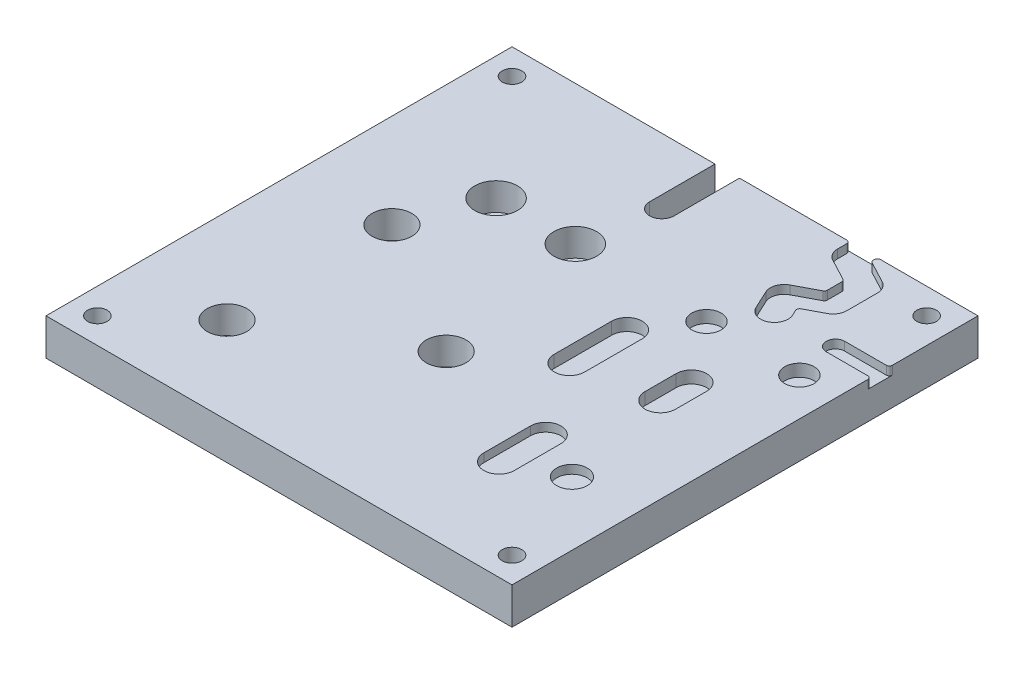
from build123d import *

# Parameters (mm, degrees)
BASE_PLATE_R        = 1.6
EXTRUDE_1_DEPTH     = 6
CUT_EXTRUDE_START   = -6
SKETCH_1_R          = 3.25
SKETCH_1_R_2        = 3.5
CUT_EXTRUDE_1_DEPTH = 4.5
SKETCH_1_6_R        = 2.4
CUT_EXTRUDE_2_DEPTH = 2
SKETCH_1_7_R        = 2.5
CUT_EXTRUDE_3_DEPTH = 1.4
FILLET_2_R          = 0.5


with BuildPart() as part:
    # Base plate → 凸台-拉伸1 (new body)
    with BuildSketch(Plane(origin=(0, 0, 0), x_dir=(1, 0, 0), z_dir=(0, 1, 0))):
        with BuildLine():
            Line((-38.1, -38.1), (38.1, -38.1))
            Line((38.1, -38.1), (38.1, 38.1))
            Line((38.1, 38.1), (-0.9, 38.1))
            Line((-0.9, 38.1), (-0.9, 27.4))
            ThreePointArc((-0.9, 27.4), (-2.9, 25.4), (-4.9, 27.4))
            Line((-4.9, 27.4), (-4.9, 38.1))
            Line((-4.9, 38.1), (-38.1, 38.1))
            Line((-38.1, 38.1), (-38.1, -38.1))
        make_face()
        with Locations(Location((-33.9, -33.9, 0), (0, 0, 270))):
            Circle(BASE_PLATE_R, mode=Mode.SUBTRACT)
        with Locations(Location((33.9, -33.9, 0), (0, 0, 270))):
            Circle(BASE_PLATE_R, mode=Mode.SUBTRACT)
        with Locations(Location((-33.9, 33.9, 0), (0, 0, 270))):
            Circle(BASE_PLATE_R, mode=Mode.SUBTRACT)
        with Locations(Location((33.9, 33.9, 0), (0, 0, 270))):
            Circle(BASE_PLATE_R, mode=Mode.SUBTRACT)
    extrude(amount=EXTRUDE_1_DEPTH)

    # 草图1 → 切除-拉伸1 (cut)
    with BuildSketch(Plane.XZ.offset(CUT_EXTRUDE_START)):
        with Locations(Location((-0.35, 10.415, 0), (0, 0, 90))):
            Circle(SKETCH_1_R)
        with Locations(Location((-22.7, 23.9, 0), (0, 0, 90))):
            Circle(SKETCH_1_R)
        with Locations(Location((-22.7, -3.07, 0), (0, 0, 90))):
            Circle(SKETCH_1_R)
        with Locations(Location((-17.96, -15.36, 0), (0, 0, 90))):
            Circle(SKETCH_1_R_2)
        with Locations(Location((-5.01, -15.36, 0), (0, 0, 90))):
            Circle(SKETCH_1_R_2)
    extrude(amount=CUT_EXTRUDE_1_DEPTH, mode=Mode.SUBTRACT)

    # 草图1<6> → 切除-拉伸2 (cut)
    with BuildSketch(Plane.XZ.offset(CUT_EXTRUDE_START)):
        with BuildLine():
            Line((8.9, 2), (8.9, -7.4))
            ThreePointArc((8.9, -7.4), (11.4, -9.9), (13.9, -7.4))
            Line((13.9, -7.4), (13.9, 2))
            ThreePointArc((13.9, 2), (11.4, 4.5), (8.9, 2))
        make_face()
        with BuildLine():
            Line((21.6, -0.16), (21.6, -5.24))
            ThreePointArc((21.6, -5.24), (24.1, -7.74), (26.6, -5.24))
            Line((26.6, -5.24), (26.6, -0.16))
            ThreePointArc((26.6, -0.16), (24.1, 2.34), (21.6, -0.16))
        make_face()
        with Locations(Location((31.9, -15.1, 0), (0, 0, 90))):
            Circle(SKETCH_1_6_R)
        with Locations(Location((16.7, -15.1, 0), (0, 0, 90))):
            Circle(SKETCH_1_6_R)
    extrude(amount=CUT_EXTRUDE_2_DEPTH, mode=Mode.SUBTRACT)

    # 草图1<7> → 切除-拉伸3 (cut)
    with BuildSketch(Plane.XZ.offset(CUT_EXTRUDE_START)):
        with BuildLine():
            Line((17.15, -38.1), (21.65, -38.1))
            Line((21.65, -38.1), (21.65, -37.1))
            Line((21.65, -37.1), (21.65, -36.1))
            ThreePointArc((21.65, -36.1), (20.560909108, -34.172620939), (18.347964405, -34.111100529))
            ThreePointArc((18.347964405, -34.111100529), (17.472620939, -34.939090892), (17.15, -36.1))
            Line((17.15, -36.1), (17.15, -38.1))
        make_face()
        with BuildLine():
            Line((21.65, -36.1), (21.65, -37.1))
            Line((21.65, -37.1), (25.452035595, -35.088899471))
            ThreePointArc((25.452035595, -35.088899471), (23.239090892, -35.027379061), (22.15, -33.1))
            Line((22.15, -33.1), (22.15, -32.1))
            Line((22.15, -32.1), (18.347964405, -34.111100529))
            ThreePointArc((18.347964405, -34.111100529), (20.560909108, -34.172620939), (21.65, -36.1))
        make_face()
        with BuildLine():
            ThreePointArc((22.15, -33.1), (24.4, -35.35), (26.65, -33.1))
            Line((26.65, -33.1), (26.65, -28.1))
            ThreePointArc((26.65, -28.1), (24.4, -25.85), (22.15, -28.1))
            Line((22.15, -28.1), (22.15, -33.1))
        make_face()
        with BuildLine():
            Line((18.347964405, -27.088899471), (22.15, -29.1))
            Line((22.15, -29.1), (22.15, -28.1))
            ThreePointArc((22.15, -28.1), (23.239090892, -26.172620939), (25.452035595, -26.111100529))
            Line((25.452035595, -26.111100529), (22.211102988, -24.396797462))
            Line((22.211102988, -24.396797462), (21.438912065, -26.051492297))
            ThreePointArc((21.438912065, -26.051492297), (20.115915291, -27.233064766), (18.347964405, -27.088899471))
        make_face()
        with BuildLine():
            Line((18.761087935, -21.148507703), (17.361087935, -24.148507703))
            ThreePointArc((17.361087935, -24.148507703), (18.448507703, -27.138912065), (21.438912065, -26.051492297))
            Line((21.438912065, -26.051492297), (22.838912065, -23.051492297))
            ThreePointArc((22.838912065, -23.051492297), (21.751492297, -20.061087935), (18.761087935, -21.148507703))
        make_face()
        with BuildLine():
            Line((38.1, -20.6), (30.8, -20.6))
            ThreePointArc((30.8, -20.6), (29.3, -22.1), (30.8, -23.6))
            Line((30.8, -23.6), (38.1, -23.6))
            Line((38.1, -23.6), (38.1, -20.6))
        make_face()
        with BuildLine():
            Line((17.1, 21.71), (17.1, 14.09))
            ThreePointArc((17.1, 14.09), (19.6, 11.59), (22.1, 14.09))
            Line((22.1, 14.09), (22.1, 21.71))
            ThreePointArc((22.1, 21.71), (19.6, 24.21), (17.1, 21.71))
        make_face()
        with Locations(Location((27.7, 17.9, 0), (0, 0, 90))):
            Circle(SKETCH_1_7_R)
    extrude(amount=CUT_EXTRUDE_3_DEPTH, mode=Mode.SUBTRACT)

    # 圆角2
    fillet_2_edges = [part.edges().sort_by_distance(p)[0] for p in [
        (38.1, 5.3, -23.6),
        (38.1, 5.3, -20.6),
        (21.65, 5.3, -38.1),
        (21.65, 5.3, -37.1),
        (22.211102988, 5.3, -24.396797462),
        (22.15, 5.3, -29.1),
        (22.15, 5.3, -32.1),
        (17.15, 5.3, -38.1),
    ]]
    fillet(fillet_2_edges, radius=FILLET_2_R)


solid = part.part
